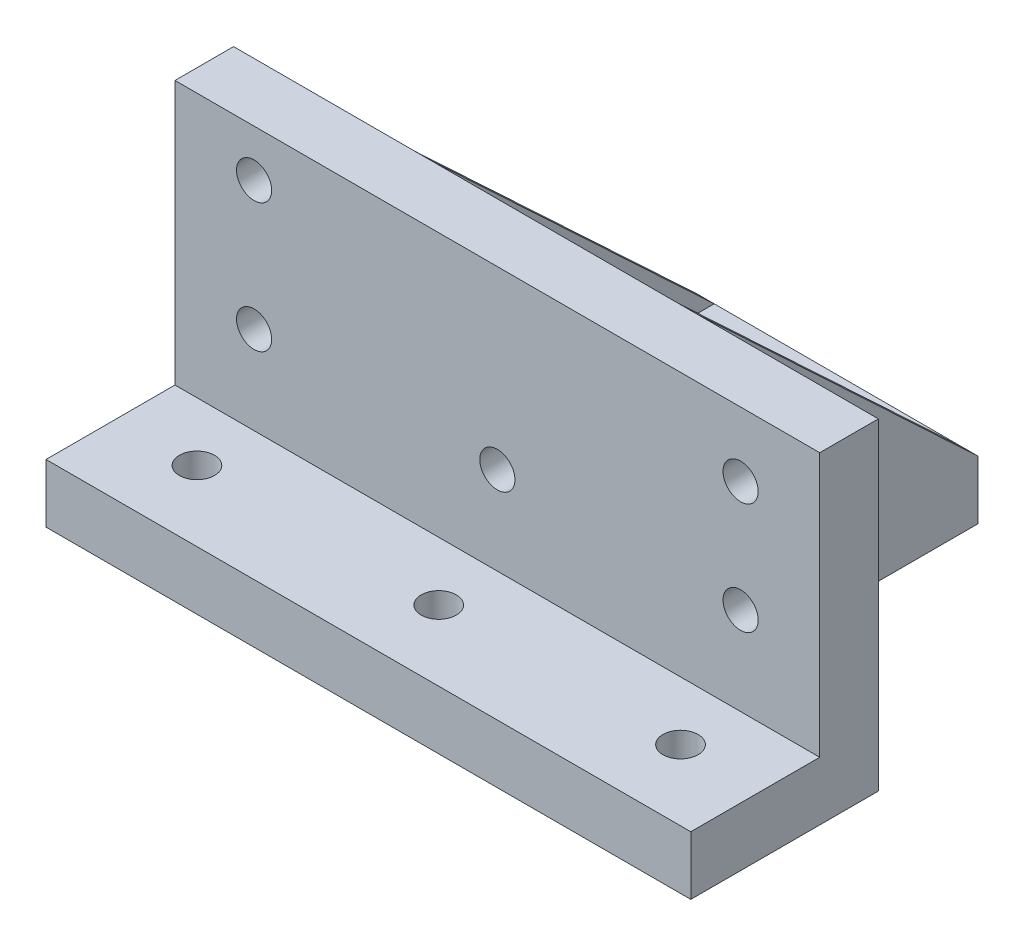
from build123d import *

# Parameters (mm, degrees)
SKETCH_1_R           = 12
SKETCH_1_R_2         = 1.75
EXTRUDE_1_DEPTH      = 10
SKETCH_2_W           = 110
SKETCH_2_H           = 10
EXTRUDE_2_DEPTH      = 45
SKETCH_5_R           = 3
CUT_EXTRUDE_2_DEPTH  = 91.47651629
SKETCH_6_R           = 5
CUT_EXTRUDE_3_DEPTH  = 5
SKETCH_7_R           = 3
CUT_EXTRUDE_4_DEPTH  = 98.025769773
SKETCH_8_R           = 5
CUT_EXTRUDE_5_DEPTH  = 5
EXTRUDE_3_DEPTH      = 3
EXTRUDE_4_DEPTH      = 3
SKETCH_14_R          = 3
CUT_EXTRUDE_9_DEPTH  = 98.025769773
SKETCH_15_R          = 5
CUT_EXTRUDE_10_DEPTH = 5
SKETCH_16_R          = 3
CUT_EXTRUDE_11_DEPTH = 5


with BuildPart() as part:
    # Эскиз1 → Бобышка-Вытянуть1 (new body)
    with BuildSketch(Plane(origin=(0, 0, 0), x_dir=(1, 0, 0), z_dir=(0, 1, 0))):
        Polygon((-24, 24), (24, 24), (24, -24), (55, -24), (55, -56), (-55, -56), (-55, -24), (-24, -24), align=None)
        with Locations(Location((0, 0, 0), (0, 0, 270))):
            Circle(SKETCH_1_R, mode=Mode.SUBTRACT)
        with Locations(Location((-16, 16, 0), (0, 0, 270))):
            Circle(SKETCH_1_R_2, mode=Mode.SUBTRACT)
        with Locations(Location((16, 16, 0), (0, 0, 270))):
            Circle(SKETCH_1_R_2, mode=Mode.SUBTRACT)
        with Locations(Location((16, -16, 0), (0, 0, 270))):
            Circle(SKETCH_1_R_2, mode=Mode.SUBTRACT)
        with Locations(Location((-16, -16, 0), (0, 0, 270))):
            Circle(SKETCH_1_R_2, mode=Mode.SUBTRACT)
    extrude(amount=EXTRUDE_1_DEPTH)

    # Эскиз2 → Бобышка-Вытянуть2 (add)
    with BuildSketch(Plane(origin=(0, 10, 0), x_dir=(1, 0, 0), z_dir=(0, 1, 0))):
        with Locations((0, -29)):
            Rectangle(SKETCH_2_W, SKETCH_2_H)
    extrude(amount=EXTRUDE_2_DEPTH)

    # Эскиз5 → Вырез-Вытянуть2 (cut, through all)
    with BuildSketch(Plane(origin=(0, 10, 0), x_dir=(1, 0, 0), z_dir=(0, 1, 0))):
        with Locations(Location((-41.25, -44, 0), (0, 0, 270))):
            Circle(SKETCH_5_R)
        with Locations(Location((0, -44, 0), (0, 0, 270))):
            Circle(SKETCH_5_R)
        with Locations(Location((41.25, -44, 0), (0, 0, 270))):
            Circle(SKETCH_5_R)
    extrude(amount=-CUT_EXTRUDE_2_DEPTH, mode=Mode.SUBTRACT)

    # Эскиз6 → Вырез-Вытянуть3 (cut)
    with BuildSketch(Plane.XZ):
        with Locations(Location((-41.25, 44, 0), (0, 0, 270))):
            Circle(SKETCH_6_R)
        with Locations(Location((0, 44, 0), (0, 0, 270))):
            Circle(SKETCH_6_R)
        with Locations(Location((41.25, 44, 0), (0, 0, 270))):
            Circle(SKETCH_6_R)
    extrude(amount=-CUT_EXTRUDE_3_DEPTH, mode=Mode.SUBTRACT)

    # Эскиз7 → Вырез-Вытянуть4 (cut, through all)
    with BuildSketch(Plane.XY.offset(34)):
        with Locations((-41.5, 25)):
            Circle(SKETCH_7_R)
        with Locations((41.5, 25)):
            Circle(SKETCH_7_R)
        with Locations((0, 25)):
            Circle(SKETCH_7_R)
    extrude(amount=-CUT_EXTRUDE_4_DEPTH, mode=Mode.SUBTRACT)

    # Эскиз8 → Вырез-Вытянуть5 (cut)
    with BuildSketch(Plane(origin=(0, 0, 24), x_dir=(-1, 0, 0), z_dir=(0, 0, -1))):
        with Locations((-41.5, 25)):
            Circle(SKETCH_8_R)
        with Locations((0, 25)):
            Circle(SKETCH_8_R)
        with Locations((41.5, 25)):
            Circle(SKETCH_8_R)
    extrude(amount=-CUT_EXTRUDE_5_DEPTH, mode=Mode.SUBTRACT)

    # Эскиз10 → Бобышка-Вытянуть3 (add)
    with BuildSketch(Plane(origin=(24, 0, 0), x_dir=(0, 0, -1), z_dir=(1, 0, 0))):
        Polygon((-24, 10), (-24, 55), (24, 10), align=None)
    extrude(amount=-EXTRUDE_3_DEPTH)

    # Эскиз11 → Бобышка-Вытянуть4 (add)
    with BuildSketch(Plane.ZY.offset(24)):
        Polygon((24, 10), (-24, 10), (24, 55), align=None)
    extrude(amount=-EXTRUDE_4_DEPTH)

    # Эскиз14 → Вырез-Вытянуть9 (cut, through all)
    with BuildSketch(Plane.XY.offset(34)):
        with Locations((-41.5, 47.004834378)):
            Circle(SKETCH_14_R)
        with Locations((41.5, 44.004834378)):
            Circle(SKETCH_14_R)
    extrude(amount=-CUT_EXTRUDE_9_DEPTH, mode=Mode.SUBTRACT)

    # Эскиз15 → Вырез-Вытянуть10 (cut)
    with BuildSketch(Plane(origin=(0, 0, 24), x_dir=(-1, 0, 0), z_dir=(0, 0, -1))):
        with Locations((41.5, 47.004834378)):
            Circle(SKETCH_15_R)
        with Locations((-41.5, 44.004834378)):
            Circle(SKETCH_15_R)
    extrude(amount=-CUT_EXTRUDE_10_DEPTH, mode=Mode.SUBTRACT)

    # Эскиз16 → Вырез-Вытянуть11 (cut)
    with BuildSketch(Plane(origin=(0, 10, 0), x_dir=(1, 0, 0), z_dir=(0, 1, 0))):
        with Locations(Location((16, 16, 0), (0, 0, 270))):
            Circle(SKETCH_16_R)
        with Locations(Location((16, -16, 0), (0, 0, 270))):
            Circle(SKETCH_16_R)
        with Locations(Location((-16, 16, 0), (0, 0, 270))):
            Circle(SKETCH_16_R)
        with Locations(Location((-16, -16, 0), (0, 0, 270))):
            Circle(SKETCH_16_R)
    extrude(amount=-CUT_EXTRUDE_11_DEPTH, mode=Mode.SUBTRACT)


solid = part.part
